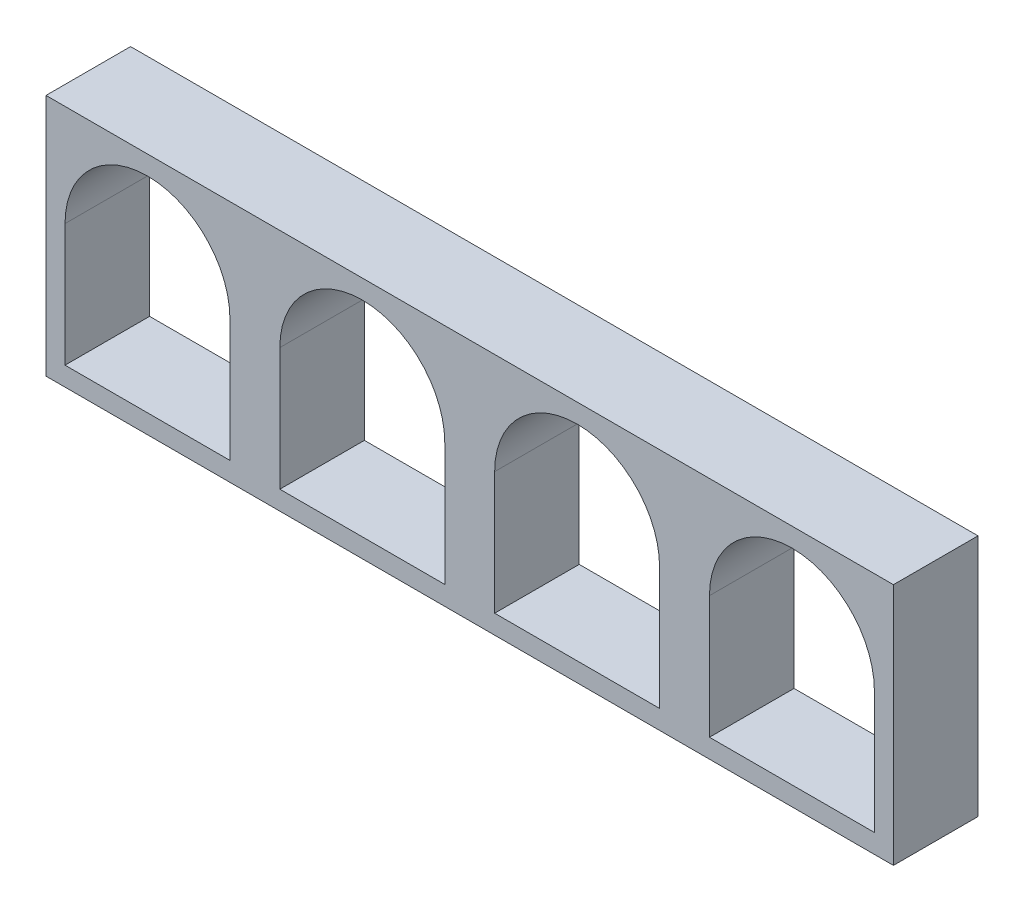
from build123d import *

# Parameters (mm, degrees)
SKETCH2_W           = 100.2
SKETCH2_H           = 28.75
BOSS_EXTRUDE1_DEPTH = 10


with BuildPart() as part:
    # Sketch2 → Boss-Extrude1 (new body)
    with BuildSketch(Plane.XY):
        with Locations((38.1, -2.375)):
            Rectangle(SKETCH2_W, SKETCH2_H)
        with BuildLine():
            Line((-9.75, -14.5), (-9.75, 0))
            ThreePointArc((-9.75, 0), (0, 9.75), (9.75, 0))
            Line((9.75, 0), (9.75, -14.5))
            Line((9.75, -14.5), (-9.75, -14.5))
        make_face(mode=Mode.SUBTRACT)
        with BuildLine():
            Line((15.65, -14.5), (15.65, 0))
            ThreePointArc((15.65, 0), (25.4, 9.75), (35.15, 0))
            Line((35.15, 0), (35.15, -14.5))
            Line((35.15, -14.5), (15.65, -14.5))
        make_face(mode=Mode.SUBTRACT)
        with BuildLine():
            Line((41.05, -14.5), (41.05, 0))
            ThreePointArc((41.05, 0), (50.8, 9.75), (60.55, 0))
            Line((60.55, 0), (60.55, -14.5))
            Line((60.55, -14.5), (41.05, -14.5))
        make_face(mode=Mode.SUBTRACT)
        with BuildLine():
            Line((66.45, -14.5), (66.45, 0))
            ThreePointArc((66.45, 0), (76.2, 9.75), (85.95, 0))
            Line((85.95, 0), (85.95, -14.5))
            Line((85.95, -14.5), (66.45, -14.5))
        make_face(mode=Mode.SUBTRACT)
    extrude(amount=BOSS_EXTRUDE1_DEPTH)


solid = part.part
